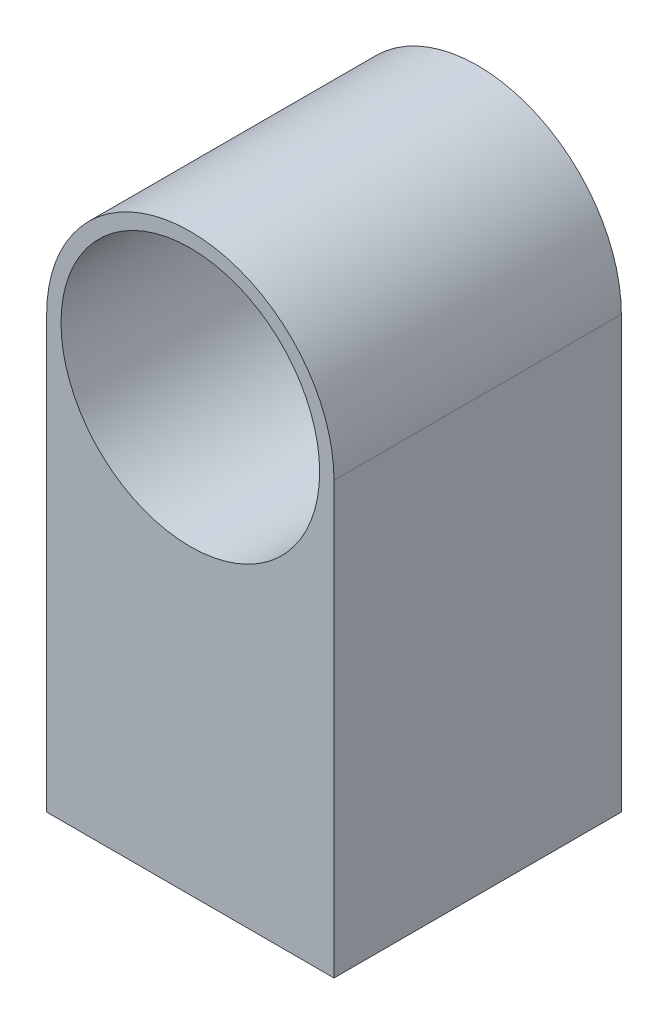
from build123d import *

# Parameters (mm, degrees)
SKETCH1_R           = 45
BOSS_EXTRUDE1_DEPTH = 100


with BuildPart() as part:
    # Sketch1 → Boss-Extrude1 (new body)
    with BuildSketch(Plane.XY):
        with BuildLine():
            Line((0, 0), (0, -150))
            Line((0, -150), (100, -150))
            Line((100, -150), (100, 0))
            ThreePointArc((100, 0), (50, 50), (0, 0))
        make_face()
        with Locations((50, 0)):
            Circle(SKETCH1_R, mode=Mode.SUBTRACT)
    extrude(amount=BOSS_EXTRUDE1_DEPTH)


solid = part.part
